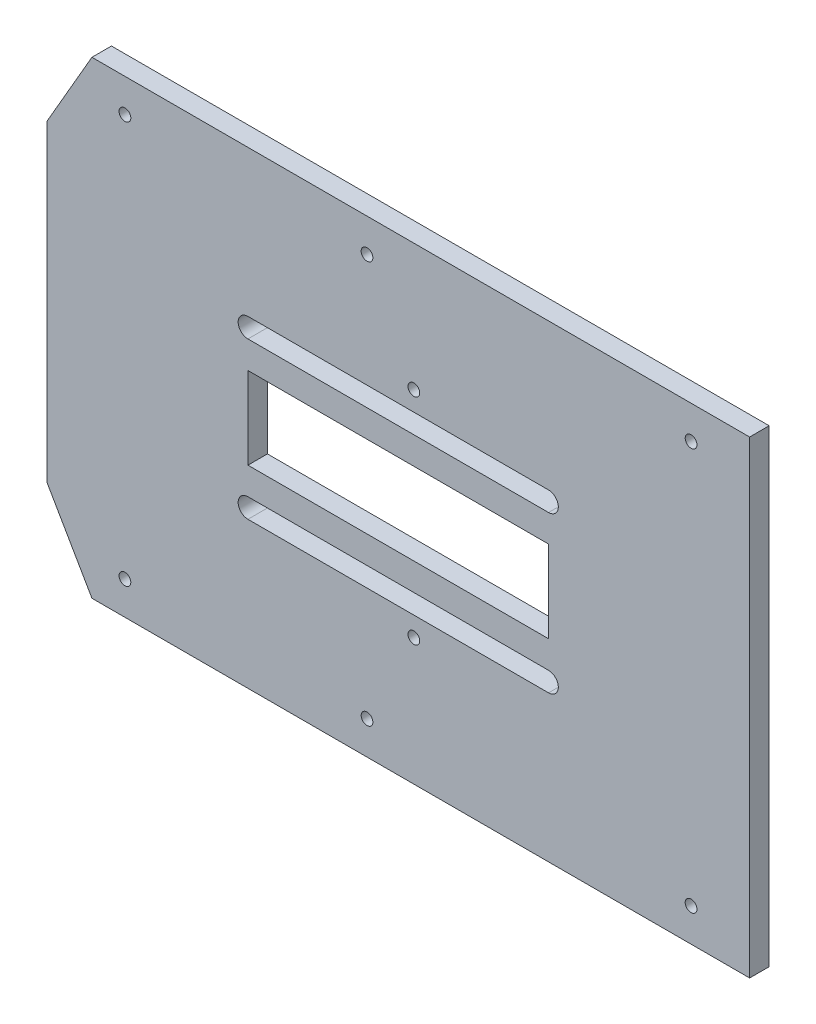
from build123d import *

# Parameters (mm, degrees)
BOSS_EXTRU_1_DEPTH      = 5
ENL_V_MAT_EXTRU_1_REACH = 110.282
ESQUISSE2_W             = 77
ESQUISSE2_H             = 21
ENL_V_MAT_EXTRU_2_REACH = 110.282
ESQUISSE4_R             = 1.5
ENL_V_MAT_EXTRU_3_DEPTH = 5


with BuildPart() as part:
    # Esquisse1 → Boss.-Extru.1 (new body)
    with BuildSketch(Plane.XY):
        Polygon((-90, 0), (90, 0), (90, 60), (-78.452994616, 60), (-90, 40), align=None)
    boss_extru_1 = extrude(amount=BOSS_EXTRU_1_DEPTH)

    # Symétrie1: Boss.-Extru.1 across Top Plane
    add(boss_extru_1.mirror(Plane(origin=(0, 0, 0), x_dir=(1, 0, 0), z_dir=(0, 1, 0))))

    # Esquisse2 → Enlèv. mat.-Extru.1 (cut, up to next)
    with BuildSketch(Plane.XY.offset(5), mode=Mode.PRIVATE) as enl_v_mat_extru_1_sk1:
        Rectangle(ESQUISSE2_W, ESQUISSE2_H)
    enl_v_mat_extru_1_tool1 = extrude(enl_v_mat_extru_1_sk1.sketch, amount=-ENL_V_MAT_EXTRU_1_REACH, mode=Mode.PRIVATE) & part.part
    add(enl_v_mat_extru_1_tool1.solids().sort_by_distance((0, 0, 5))[0], mode=Mode.SUBTRACT)

    # Esquisse3 → Enlèv. mat.-Extru.2 (cut, up to next)
    with BuildSketch(Plane.XY.offset(5), mode=Mode.PRIVATE) as enl_v_mat_extru_2_sk1:
        with BuildLine():
            Line((-38.5, 22.5), (38.5, 22.5))
            ThreePointArc((38.5, 22.5), (41, 20), (38.5, 17.5))
            Line((38.5, 17.5), (-38.5, 17.5))
            ThreePointArc((-38.5, 17.5), (-41, 20), (-38.5, 22.5))
        make_face()
    enl_v_mat_extru_2_tool1 = extrude(enl_v_mat_extru_2_sk1.sketch, amount=-ENL_V_MAT_EXTRU_2_REACH, mode=Mode.PRIVATE) & part.part
    enl_v_mat_extru_2 = enl_v_mat_extru_2_tool1.solids().sort_by_distance((0, 20, 5))[0]
    add(enl_v_mat_extru_2, mode=Mode.SUBTRACT)

    # Esquisse4 → Enlèv. mat.-Extru.3 (cut)
    with BuildSketch(Plane(origin=(0, 0, 0), x_dir=(-1, 0, 0), z_dir=(0, 0, -1))):
        with Locations((-75, 51.5)):
            Circle(ESQUISSE4_R)
        with Locations((8, 51.5)):
            Circle(ESQUISSE4_R)
        with Locations((70, 51.5)):
            Circle(ESQUISSE4_R)
        with Locations((-4, 27.5)):
            Circle(ESQUISSE4_R)
    enl_v_mat_extru_3 = extrude(amount=-ENL_V_MAT_EXTRU_3_DEPTH, mode=Mode.SUBTRACT)

    # Symétrie2: Enlèv. mat.-Extru.3 across plane
    add(enl_v_mat_extru_3.mirror(Plane.ZX), mode=Mode.SUBTRACT)

    # Symétrie3: Enlèv. mat.-Extru.2 across plane
    add(enl_v_mat_extru_2.mirror(Plane.ZX), mode=Mode.SUBTRACT)


solid = part.part
